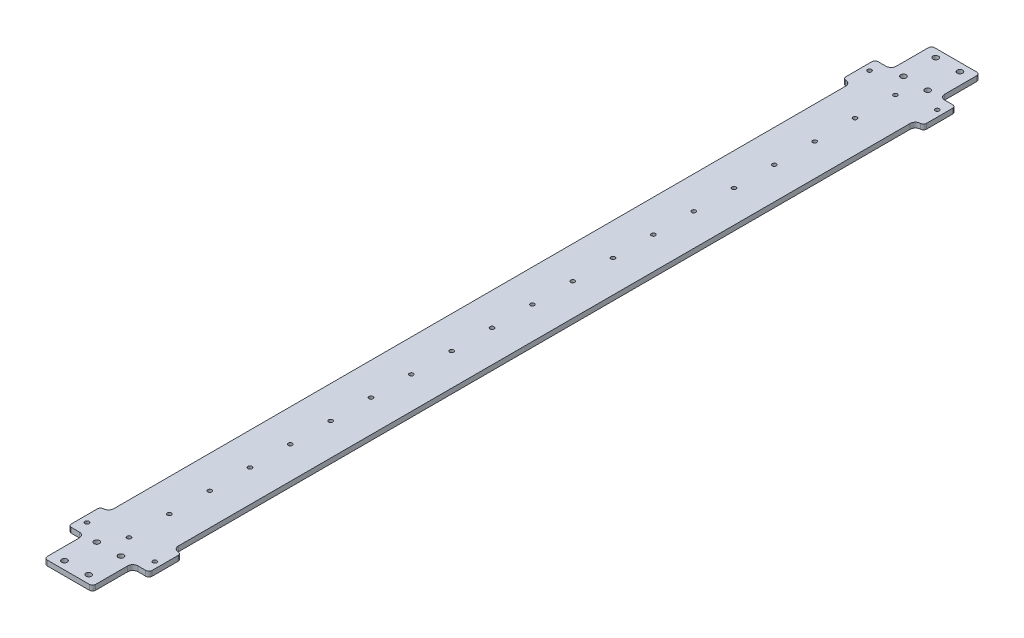
from build123d import *

# Parameters (mm, degrees)
BOSS_EXTRUDE1_DEPTH         = 3.175
FILLET1_R                   = 3.175
M3_CLEARANCE_HOLE1_D        = 3.4
FILLET2_R                   = 2
TAP_DRILL_FOR_M3X0_5_TAP1_D = 2.5
LPATTERN1_COUNT             = 10
LPATTERN1_PITCH             = 25
TAP_DRILL_FOR_M3X0_5_TAP2_D = 2.5
MIRROR1_COPY_1_D            = 2.5
MIRROR1_COPY_2_D            = 2.5
MIRROR1_COPY_3_D            = 2.5
MIRROR1_COPY_4_D            = 2.5
MIRROR1_COPY_5_D            = 2.5
MIRROR1_COPY_6_D            = 2.5
MIRROR1_COPY_7_D            = 2.5
MIRROR1_COPY_8_D            = 2.5
MIRROR1_COPY_9_D            = 2.5
FILLET1_OF_MIRROR1_R        = 3.175
FILLET2_OF_MIRROR1_R        = 2


with BuildPart() as part:
    # Sketch2 → Boss-Extrude1 (new body)
    with BuildSketch(Plane(origin=(0, 0, 0), x_dir=(1, 0, 0), z_dir=(0, 1, 0))):
        Polygon((-20, 0), (20, 0), (20, 230), (25, 230), (25, 250), (15, 250), (15, 275), (-15, 275), (-15, 250), (-25, 250), (-25, 230), (-20, 230), align=None)
    boss_extrude1 = extrude(amount=BOSS_EXTRUDE1_DEPTH)

    # Fillet1
    fillet1_edges = [part.edges().sort_by_distance(p)[0] for p in [
        (-20, 1.5875, -230),
        (-15, 1.5875, -250),
        (15, 1.5875, -250),
        (20, 1.5875, -230),
    ]]
    fillet(fillet1_edges, radius=FILLET1_R)

    # M3 Clearance Hole1 (through all)
    with Locations(Plane(origin=(-7.381007447, 3.175, -270), x_dir=(0, 0, 1), z_dir=(0, 1, 0))):
        with Locations((0, 0), (20, 0), (0, 15), (20, 15)):
            m3_clearance_hole1 = Hole(M3_CLEARANCE_HOLE1_D / 2)

    # Fillet2
    fillet2_edges = [part.edges().sort_by_distance(p)[0] for p in [
        (-25, 1.5875, -250),
        (15, 1.5875, -275),
        (-15, 1.5875, -275),
        (-25, 1.5875, -230),
        (25, 1.5875, -230),
        (25, 1.5875, -250),
    ]]
    fillet(fillet2_edges, radius=FILLET2_R)

    # Tap Drill for M3x0.5 Tap1 (through all)
    with Locations(Plane(origin=(0.113042925, 3.175, -237.5), x_dir=(0, 0, 1), z_dir=(0, 1, 0))):
        with Locations((0, 0)):
            tap_drill_for_m3x0_5_tap1 = Hole(TAP_DRILL_FOR_M3X0_5_TAP1_D / 2)

    # LPattern1: Tap Drill for M3x0.5 Tap1 ×10
    with Locations(*[(0, 0, i * LPATTERN1_PITCH) for i in range(1, LPATTERN1_COUNT)]):
        add(tap_drill_for_m3x0_5_tap1, mode=Mode.SUBTRACT)

    # Tap Drill for M3x0.5 Tap2 (through all)
    with Locations(Plane(origin=(-20.886041747, 3.175, -242.5), x_dir=(0, 0, 1), z_dir=(0, 1, 0))):
        with Locations((0, 0), (0, 42)):
            tap_drill_for_m3x0_5_tap2 = Hole(TAP_DRILL_FOR_M3X0_5_TAP2_D / 2)

    # Mirror1: Boss-Extrude1, M3 Clearance Hole1, Tap Drill for M3x0.5 Tap1, Tap Drill for M3x0.5 Tap2 across plane
    add(boss_extrude1.mirror(Plane.XY))
    add(m3_clearance_hole1.mirror(Plane.XY), mode=Mode.SUBTRACT)
    add(tap_drill_for_m3x0_5_tap1.mirror(Plane.XY), mode=Mode.SUBTRACT)
    add(tap_drill_for_m3x0_5_tap2.mirror(Plane.XY), mode=Mode.SUBTRACT)

    # Mirror1 copy 1 (through all)
    with Locations(Plane(origin=(0.113042925, 3.175, 212.5), x_dir=(0, 0, -1), z_dir=(0, 1, 0))):
        with Locations((0, 0)):
            Hole(MIRROR1_COPY_1_D / 2)

    # Mirror1 copy 2 (through all)
    with Locations(Plane(origin=(0.113042925, 3.175, 187.5), x_dir=(0, 0, -1), z_dir=(0, 1, 0))):
        with Locations((0, 0)):
            Hole(MIRROR1_COPY_2_D / 2)

    # Mirror1 copy 3 (through all)
    with Locations(Plane(origin=(0.113042925, 3.175, 162.5), x_dir=(0, 0, -1), z_dir=(0, 1, 0))):
        with Locations((0, 0)):
            Hole(MIRROR1_COPY_3_D / 2)

    # Mirror1 copy 4 (through all)
    with Locations(Plane(origin=(0.113042925, 3.175, 137.5), x_dir=(0, 0, -1), z_dir=(0, 1, 0))):
        with Locations((0, 0)):
            Hole(MIRROR1_COPY_4_D / 2)

    # Mirror1 copy 5 (through all)
    with Locations(Plane(origin=(0.113042925, 3.175, 112.5), x_dir=(0, 0, -1), z_dir=(0, 1, 0))):
        with Locations((0, 0)):
            Hole(MIRROR1_COPY_5_D / 2)

    # Mirror1 copy 6 (through all)
    with Locations(Plane(origin=(0.113042925, 3.175, 87.5), x_dir=(0, 0, -1), z_dir=(0, 1, 0))):
        with Locations((0, 0)):
            Hole(MIRROR1_COPY_6_D / 2)

    # Mirror1 copy 7 (through all)
    with Locations(Plane(origin=(0.113042925, 3.175, 62.5), x_dir=(0, 0, -1), z_dir=(0, 1, 0))):
        with Locations((0, 0)):
            Hole(MIRROR1_COPY_7_D / 2)

    # Mirror1 copy 8 (through all)
    with Locations(Plane(origin=(0.113042925, 3.175, 37.5), x_dir=(0, 0, -1), z_dir=(0, 1, 0))):
        with Locations((0, 0)):
            Hole(MIRROR1_COPY_8_D / 2)

    # Mirror1 copy 9 (through all)
    with Locations(Plane(origin=(0.113042925, 3.175, 12.5), x_dir=(0, 0, -1), z_dir=(0, 1, 0))):
        with Locations((0, 0)):
            Hole(MIRROR1_COPY_9_D / 2)

    # Fillet1 of Mirror1
    fillet1_of_mirror1_edges = [part.edges().sort_by_distance(p)[0] for p in [
        (-20, 1.5875, 230),
        (-15, 1.5875, 250),
        (15, 1.5875, 250),
        (20, 1.5875, 230),
    ]]
    fillet(fillet1_of_mirror1_edges, radius=FILLET1_OF_MIRROR1_R)

    # Fillet2 of Mirror1
    fillet2_of_mirror1_edges = [part.edges().sort_by_distance(p)[0] for p in [
        (-25, 1.5875, 250),
        (15, 1.5875, 275),
        (-15, 1.5875, 275),
        (-25, 1.5875, 230),
        (25, 1.5875, 230),
        (25, 1.5875, 250),
    ]]
    fillet(fillet2_of_mirror1_edges, radius=FILLET2_OF_MIRROR1_R)


solid = part.part
